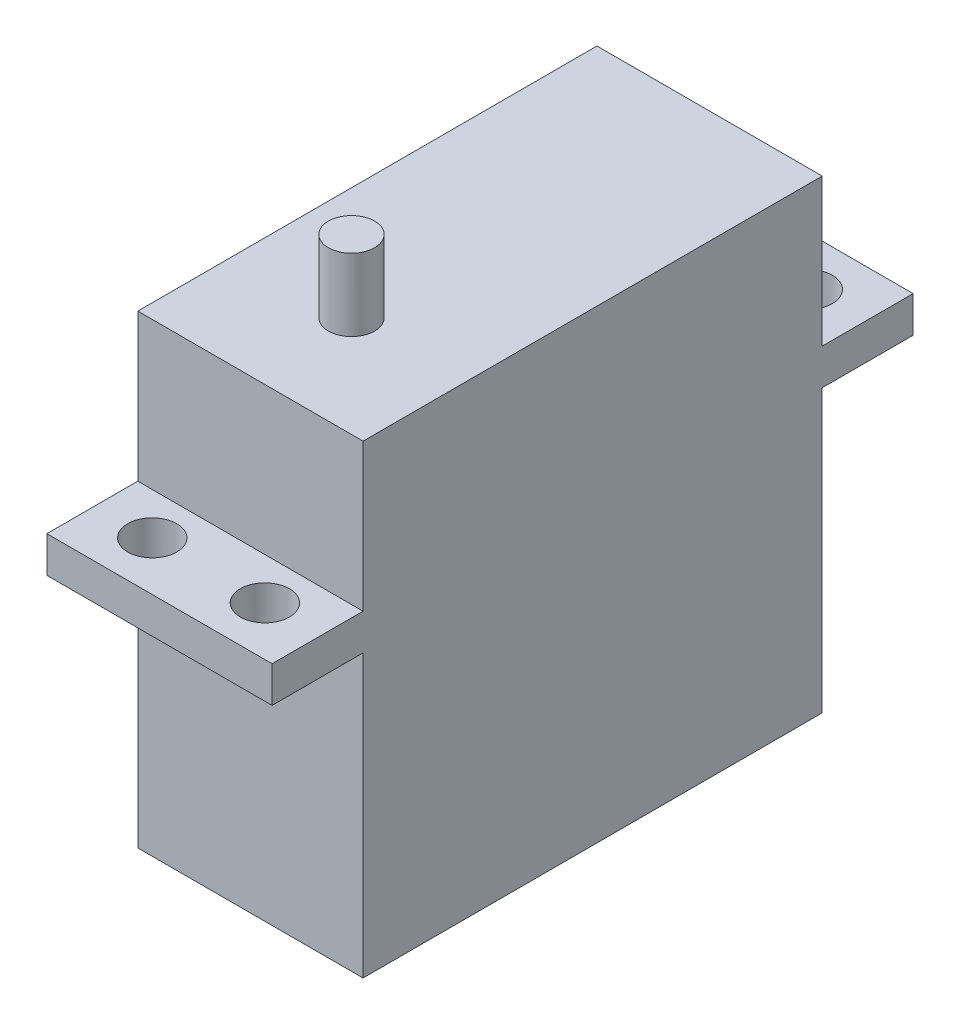
from build123d import *

# Parameters (mm, degrees)
SKETCH1_W           = 40.386
SKETCH1_H           = 40.894
BOSS_EXTRUDE1_DEPTH = 9.906
SKETCH2_W           = 56.388
SKETCH2_H           = 3.175
BOSS_EXTRUDE2_DEPTH = 19.812
SKETCH3_R           = 2.159
CUT_EXTRUDE1_DEPTH  = 19.812
SKETCH4_R           = 2.032
BOSS_EXTRUDE3_DEPTH = 6.35


with BuildPart() as part:
    # Sketch1 → Boss-Extrude1 (new, symmetric)
    with BuildSketch(Plane(origin=(0, 0, 0), x_dir=(0, 0, -1), z_dir=(1, 0, 0))):
        Rectangle(SKETCH1_W, SKETCH1_H)
    extrude(amount=BOSS_EXTRUDE1_DEPTH, both=True)

    # Sketch2 → Boss-Extrude2 (add, through all)
    with BuildSketch(Plane(origin=(9.906, 0, 0), x_dir=(0, 0, -1), z_dir=(1, 0, 0))):
        with Locations((0, 5.9055)):
            Rectangle(SKETCH2_W, SKETCH2_H)
    extrude(amount=-BOSS_EXTRUDE2_DEPTH)

    # Sketch3 → Cut-Extrude1 (cut)
    with BuildSketch(Plane(origin=(0, 7.493, 0), x_dir=(1, 0, 0), z_dir=(0, 1, 0))):
        with Locations(Location((-4.953, 23.876, 0), (0, 0, 270))):
            Circle(SKETCH3_R)
        with Locations(Location((4.953, 23.876, 0), (0, 0, 270))):
            Circle(SKETCH3_R)
        with Locations(Location((4.953, -23.876, 0), (0, 0, 270))):
            Circle(SKETCH3_R)
        with Locations(Location((-4.953, -23.876, 0), (0, 0, 270))):
            Circle(SKETCH3_R)
    extrude(amount=-CUT_EXTRUDE1_DEPTH, mode=Mode.SUBTRACT)

    # Sketch4 → Boss-Extrude3 (add)
    with BuildSketch(Plane(origin=(0, 20.447, 0), x_dir=(1, 0, 0), z_dir=(0, 1, 0))):
        with Locations(Location((0, -11.303, 0), (0, 0, 90))):
            Circle(SKETCH4_R)
    extrude(amount=BOSS_EXTRUDE3_DEPTH)


solid = part.part
